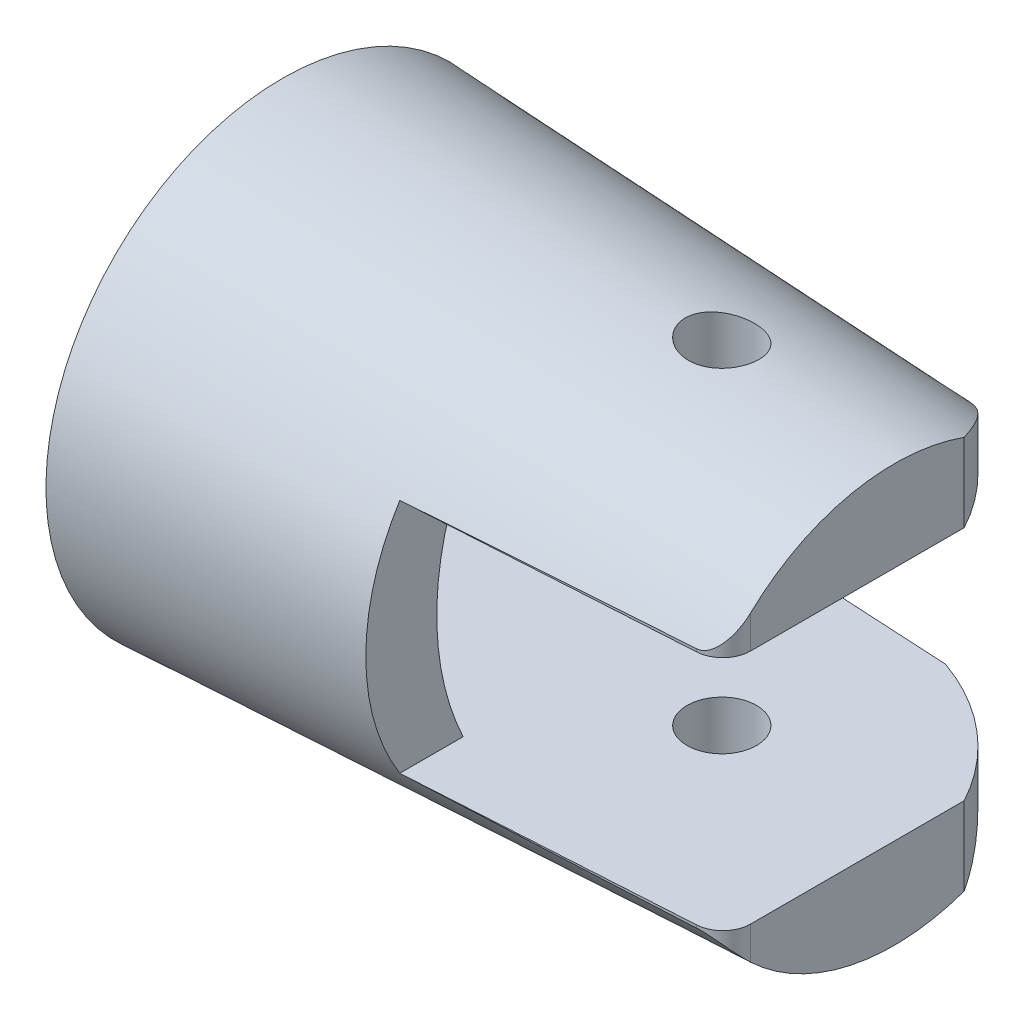
from build123d import *

# Parameters (mm, degrees)
SKETCH4_R               = 8.5
SKETCH5_R               = 7.5
CUT_EXTRUDE1_DEPTH      = 10
CUT_EXTRUDE1_DEPTH_BACK = 10
SKETCH7_W               = 13.763410073
SKETCH7_H               = 8.5
CUT_EXTRUDE4_DEPTH      = 10
CUT_EXTRUDE4_DEPTH_BACK = 10
CUT_EXTRUDE5_DEPTH      = 10
CUT_EXTRUDE5_DEPTH_BACK = 10
SKETCH11_R              = 1.25
CUT_EXTRUDE6_DEPTH      = 26.069902429
FILLET1_R               = 1


with BuildPart() as part:
    # Sketch4 → Loft1 section 0
    with BuildSketch(Plane(origin=(0, 0, 0), x_dir=(0, 0, -1), z_dir=(1, 0, 0))):
        Circle(SKETCH4_R)
    # Sketch5 → Loft1 section 1
    with BuildSketch(Plane(origin=(22, 0, 0), x_dir=(0, 0, -1), z_dir=(1, 0, 0))):
        Circle(SKETCH5_R)
    loft()

    # Sketch7 → Cut-Extrude1 (cut, two sides: drawn at the far end of the back side and taken through both)
    with BuildSketch(Plane.XY.offset(-CUT_EXTRUDE1_DEPTH_BACK)):
        with Locations((17.881705037, 0)):
            Rectangle(SKETCH7_W, SKETCH7_H)
    extrude(amount=CUT_EXTRUDE1_DEPTH + CUT_EXTRUDE1_DEPTH_BACK, mode=Mode.SUBTRACT)

    # Sketch8 → Cut-Extrude4 (cut, two sides: drawn at the far end of the back side and taken through both)
    with BuildSketch(Plane(origin=(0, 0, 0), x_dir=(1, 0, 0), z_dir=(0, 1, 0)).offset(-CUT_EXTRUDE4_DEPTH_BACK)):
        with BuildLine():
            Line((11, 6.777720856), (16.53, 6.685056145))
            ThreePointArc((16.53, 6.685056145), (21.20100697, 3.731621267), (23, -1.493769414))
            Line((23, -1.493769414), (23, -6.043769414))
            Line((23, -6.043769414), (11, -6.777720856))
            Line((11, -6.777720856), (11, -9.08468988))
            Line((11, -9.08468988), (27.197187836, -9.08468988))
            Line((27.197187836, -9.08468988), (27.197187836, 11.602386845))
            Line((27.197187836, 11.602386845), (11, 11.602386845))
            Line((11, 11.602386845), (11, 6.777720856))
        make_face()
    extrude(amount=CUT_EXTRUDE4_DEPTH + CUT_EXTRUDE4_DEPTH_BACK, mode=Mode.SUBTRACT)

    # Sketch11 → Cut-Extrude5 (cut, two sides: drawn at the far end of the back side and taken through both)
    with BuildSketch(Plane(origin=(0, 0, 0), x_dir=(1, 0, 0), z_dir=(0, 1, 0)).offset(-CUT_EXTRUDE5_DEPTH_BACK)):
        with Locations(Location((15.3, 0.5, 0), (0, 0, 136.441515333))):
            Circle(SKETCH11_R)
    extrude(amount=CUT_EXTRUDE5_DEPTH + CUT_EXTRUDE5_DEPTH_BACK, mode=Mode.SUBTRACT)

    # Sketch12 → Cut-Extrude6 (cut, through all)
    with BuildSketch(Plane.ZY):
        with BuildLine():
            Line((-4.5, 4.25), (4.5, 4.25))
            ThreePointArc((4.5, 4.25), (5.448066505, 0), (4.5, -4.25))
            Line((4.5, -4.25), (-4.5, -4.25))
            ThreePointArc((-4.5, -4.25), (-5.448066505, 0), (-4.5, 4.25))
        make_face()
    extrude(amount=-CUT_EXTRUDE6_DEPTH, mode=Mode.SUBTRACT)

    # Fillet1
    fillet1_edges = [part.edges().sort_by_distance(p)[0] for p in [
        (22, -4.303290893, 6.104932034),
        (22, 4.303290893, 6.104932034),
    ]]
    fillet(fillet1_edges, radius=FILLET1_R)


solid = part.part
